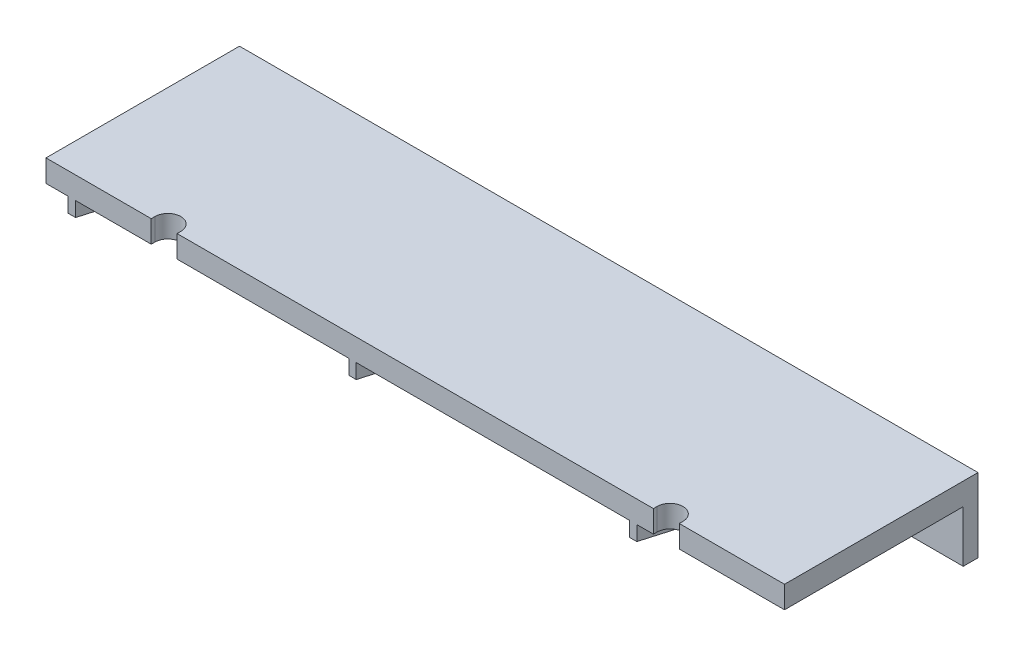
from build123d import *

# Parameters (mm, degrees)
SKETCH_1_W             = 1000
SKETCH_1_H             = 100
EXTRUDE_1_DEPTH        = 20
SKETCH_2_W             = 1000
SKETCH_2_H             = 30
EXTRUDE_2_DEPTH        = 242
EXTRUDE_START          = -30
EXTRUDE_3_DEPTH        = 10
PATTERN_LINEAR_1_COUNT = 3
PATTERN_LINEAR_1_PITCH = 380
CUT_EXTRUDE_1_DEPTH    = 574.274803214


with BuildPart() as part:
    # 草图1 → 凸台-拉伸1 (new body)
    with BuildSketch(Plane.XY):
        Rectangle(SKETCH_1_W, SKETCH_1_H)
    extrude(amount=EXTRUDE_1_DEPTH)



with BuildPart() as body_2:
    # 草图2 → 凸台-拉伸2 (new body)
    with BuildSketch(Plane.XY.offset(20)):
        with Locations((0, 35)):
            Rectangle(SKETCH_2_W, SKETCH_2_H)
    extrude(amount=EXTRUDE_2_DEPTH)


with BuildPart() as part_1:
    add(part.part)

    add(body_2.part)  # 凸台-拉伸3 merges body 2
    # 草图3 → 凸台-拉伸3 (add)
    with BuildSketch(Plane.ZY.offset(500).offset(EXTRUDE_START)):
        Polygon((262, 20), (20, 20), (20, -50), (40, -50), (262, 0), align=None)
    extrude_3 = extrude(amount=-EXTRUDE_3_DEPTH)

    # 阵列(线性)1: 凸台-拉伸3 ×3
    with Locations(*[(i * PATTERN_LINEAR_1_PITCH, 0, 0) for i in range(1, PATTERN_LINEAR_1_COUNT)]):
        add(extrude_3)

    # 草图5 → 切除-拉伸1 (cut, through all)
    with BuildSketch(Plane(origin=(0, 50, 0), x_dir=(1, 0, 0), z_dir=(0, 1, 0))):
        with BuildLine():
            Line((357.5, -256.999999998), (357.5, -337.435999102))
            ThreePointArc((357.5, -337.435999102), (340, -354.935999102), (322.5, -337.435999102))
            Line((322.5, -337.435999102), (322.5, -256.999999998))
            ThreePointArc((322.5, -256.999999998), (340, -239.499999998), (357.5, -256.999999998))
        make_face()
        with BuildLine():
            Line((-322.5, -257), (-322.5, -349.000883912))
            ThreePointArc((-322.5, -349.000883912), (-340, -366.500883912), (-357.5, -349.000883912))
            Line((-357.5, -349.000883912), (-357.5, -257))
            ThreePointArc((-357.5, -257), (-340, -239.5), (-322.5, -257))
        make_face()
    extrude(amount=-CUT_EXTRUDE_1_DEPTH, mode=Mode.SUBTRACT)


solid = part_1.part
